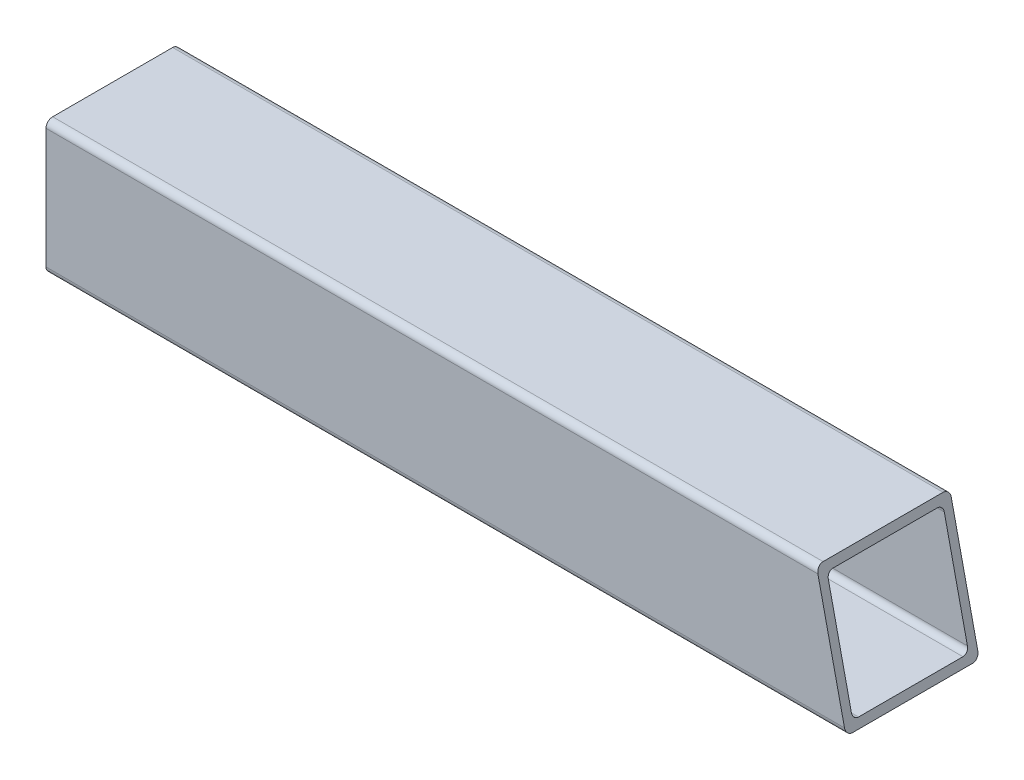
from build123d import *

# Parameters (mm, degrees)
BOSS_EXTRUDE1_DEPTH      = 76.2
BOSS_EXTRUDE1_DEPTH_BACK = 76.2
CUT_EXTRUDE1_DEPTH       = 82.319677815


with BuildPart() as part:
    # Sketch4 → Boss-Extrude1 (new, two sides: drawn at the far end of the back side and taken through both)
    with BuildSketch(Plane(origin=(0, 0, 0), x_dir=(0, 0, -1), z_dir=(1, 0, 0)).offset(-BOSS_EXTRUDE1_DEPTH_BACK)):
        with BuildLine():
            Line((12.7, -11.43), (12.7, 11.43))
            ThreePointArc((12.7, 11.43), (12.328025612, 12.328025612), (11.43, 12.7))
            Line((11.43, 12.7), (-11.43, 12.7))
            ThreePointArc((-11.43, 12.7), (-12.328025612, 12.328025612), (-12.7, 11.43))
            Line((-12.7, 11.43), (-12.7, -11.43))
            ThreePointArc((-12.7, -11.43), (-12.328025612, -12.328025612), (-11.43, -12.7))
            Line((-11.43, -12.7), (11.43, -12.7))
            ThreePointArc((11.43, -12.7), (12.328025612, -12.328025612), (12.7, -11.43))
        make_face()
        with BuildLine():
            Line((11.049, 9.9441), (11.049, -9.9441))
            ThreePointArc((11.049, -9.9441), (10.725382283, -10.725382283), (9.9441, -11.049))
            Line((9.9441, -11.049), (-9.9441, -11.049))
            ThreePointArc((-9.9441, -11.049), (-10.725382283, -10.725382283), (-11.049, -9.9441))
            Line((-11.049, -9.9441), (-11.049, 9.9441))
            ThreePointArc((-11.049, 9.9441), (-10.725382283, 10.725382283), (-9.9441, 11.049))
            Line((-9.9441, 11.049), (9.9441, 11.049))
            ThreePointArc((9.9441, 11.049), (10.725382283, 10.725382283), (11.049, 9.9441))
        make_face(mode=Mode.SUBTRACT)
    extrude(amount=BOSS_EXTRUDE1_DEPTH + BOSS_EXTRUDE1_DEPTH_BACK)

    # Sketch5 → Cut-Extrude1 (cut, through all)
    with BuildSketch(Plane.XY.offset(12.7)):
        Polygon((76.2, -12.7), (70.568955569, 12.7), (76.2, 12.7), align=None)
    extrude(amount=-CUT_EXTRUDE1_DEPTH, mode=Mode.SUBTRACT)


solid = part.part
